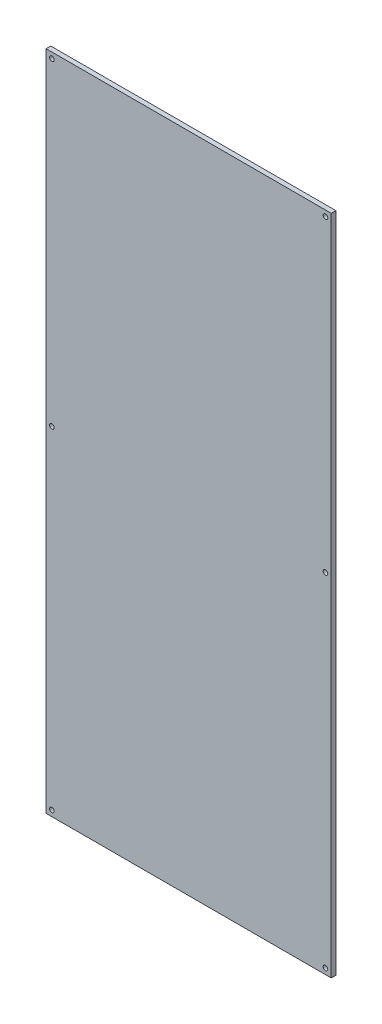
from build123d import *

# Parameters (mm, degrees)
ESQUISSE1_W        = 123.47
ESQUISSE1_H        = 286.8
ESQUISSE1_R        = 1
BOSS_EXTRU_1_DEPTH = 2


with BuildPart() as part:
    # Esquisse1 → Boss.-Extru.1 (new body)
    with BuildSketch(Plane.XY):
        with Locations((22.026079807, -112.915780731)):
            Rectangle(ESQUISSE1_W, ESQUISSE1_H)
        with Locations((-37.208920193, 27.984219269)):
            Circle(ESQUISSE1_R, mode=Mode.SUBTRACT)
        with Locations((81.261079807, 27.984219269)):
            Circle(ESQUISSE1_R, mode=Mode.SUBTRACT)
        with Locations((-37.208920193, -253.815780731)):
            Circle(ESQUISSE1_R, mode=Mode.SUBTRACT)
        with Locations((-37.208920193, -109.915780731)):
            Circle(ESQUISSE1_R, mode=Mode.SUBTRACT)
        with Locations((81.261079807, -253.815780731)):
            Circle(ESQUISSE1_R, mode=Mode.SUBTRACT)
        with Locations((81.261079807, -105.468802806)):
            Circle(ESQUISSE1_R, mode=Mode.SUBTRACT)
    extrude(amount=BOSS_EXTRU_1_DEPTH)


solid = part.part
